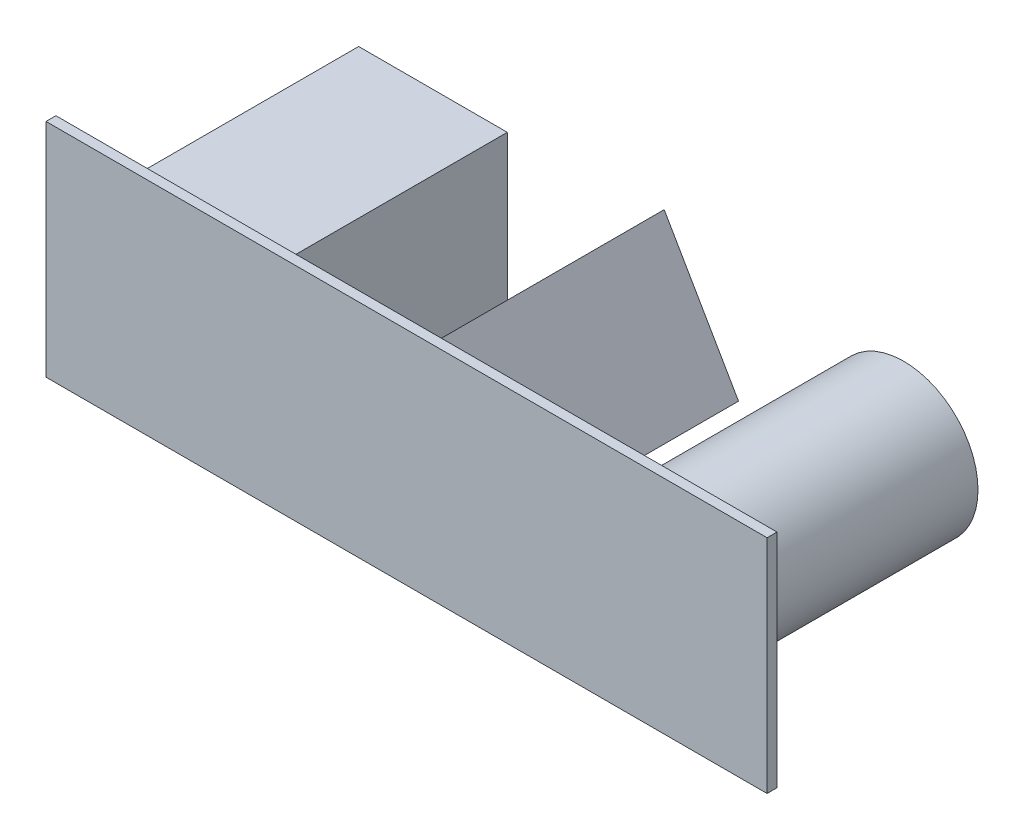
from build123d import *

# Parameters (mm, degrees)
SKETCH1_R             = 22.5
BOSS_EXTRUDE1_DEPTH   = 75
BOSS_EXTRUDE1_2_DEPTH = 75
SKETCH1_W             = 45
SKETCH1_H             = 45
BOSS_EXTRUDE1_3_DEPTH = 75
SKETCH2_W             = 218.297343906
SKETCH2_H             = 67.055865706
BOSS_EXTRUDE2_DEPTH   = 3


with BuildPart() as part:
    # Sketch1 → Boss-Extrude1 (new body)
    with BuildSketch(Plane.XY):
        with Locations((72.5, 0)):
            Circle(SKETCH1_R)
    extrude(amount=BOSS_EXTRUDE1_DEPTH)



with BuildPart() as body_2:
    # Sketch1 → Boss-Extrude1 2 (new body)
    with BuildSketch(Plane.XY):
        Polygon((-22.5, -12.990381057), (0, 25.980762114), (22.5, -12.990381057), align=None)
    extrude(amount=BOSS_EXTRUDE1_2_DEPTH)


with BuildPart() as body_3:
    # Sketch1 → Boss-Extrude1 3 (new body)
    with BuildSketch(Plane.XY):
        with Locations((-70, 0)):
            Rectangle(SKETCH1_W, SKETCH1_H)
    extrude(amount=BOSS_EXTRUDE1_3_DEPTH)


with BuildPart() as part_1:
    add(part.part)

    add(body_2.part)  # Boss-Extrude2 merges body 2

    add(body_3.part)  # Boss-Extrude2 merges body 3
    # Sketch2 → Boss-Extrude2 (add)
    with BuildSketch(Plane.XY.offset(75)):
        Rectangle(SKETCH2_W, SKETCH2_H)
    extrude(amount=BOSS_EXTRUDE2_DEPTH)


solid = part_1.part
